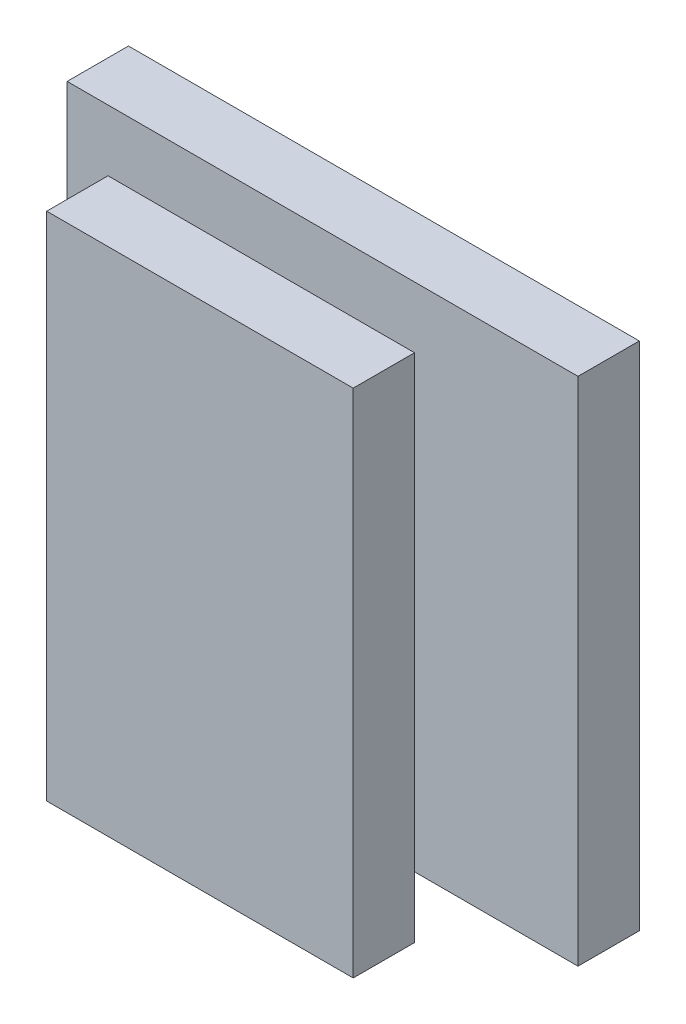
from build123d import *

# Parameters (mm, degrees)
SKETCH2_W           = 25
SKETCH2_H           = 25
BOSS_EXTRUDE2_DEPTH = 3
SKETCH3_R           = 1.5
BOSS_EXTRUDE3_DEPTH = 3
SKETCH4_W           = 15
SKETCH4_H           = 25
BOSS_EXTRUDE4_DEPTH = 3


with BuildPart() as part:
    # Sketch2 → Boss-Extrude2 (new body)
    with BuildSketch(Plane.XY):
        Rectangle(SKETCH2_W, SKETCH2_H)
    extrude(amount=BOSS_EXTRUDE2_DEPTH)

    # Sketch3 → Boss-Extrude3 (add)
    with BuildSketch(Plane.XY.offset(3)):
        Circle(SKETCH3_R)
    extrude(amount=BOSS_EXTRUDE3_DEPTH)

    # Sketch4 → Boss-Extrude4 (add)
    with BuildSketch(Plane.XY.offset(6)):
        Rectangle(SKETCH4_W, SKETCH4_H)
    extrude(amount=BOSS_EXTRUDE4_DEPTH)


solid = part.part
